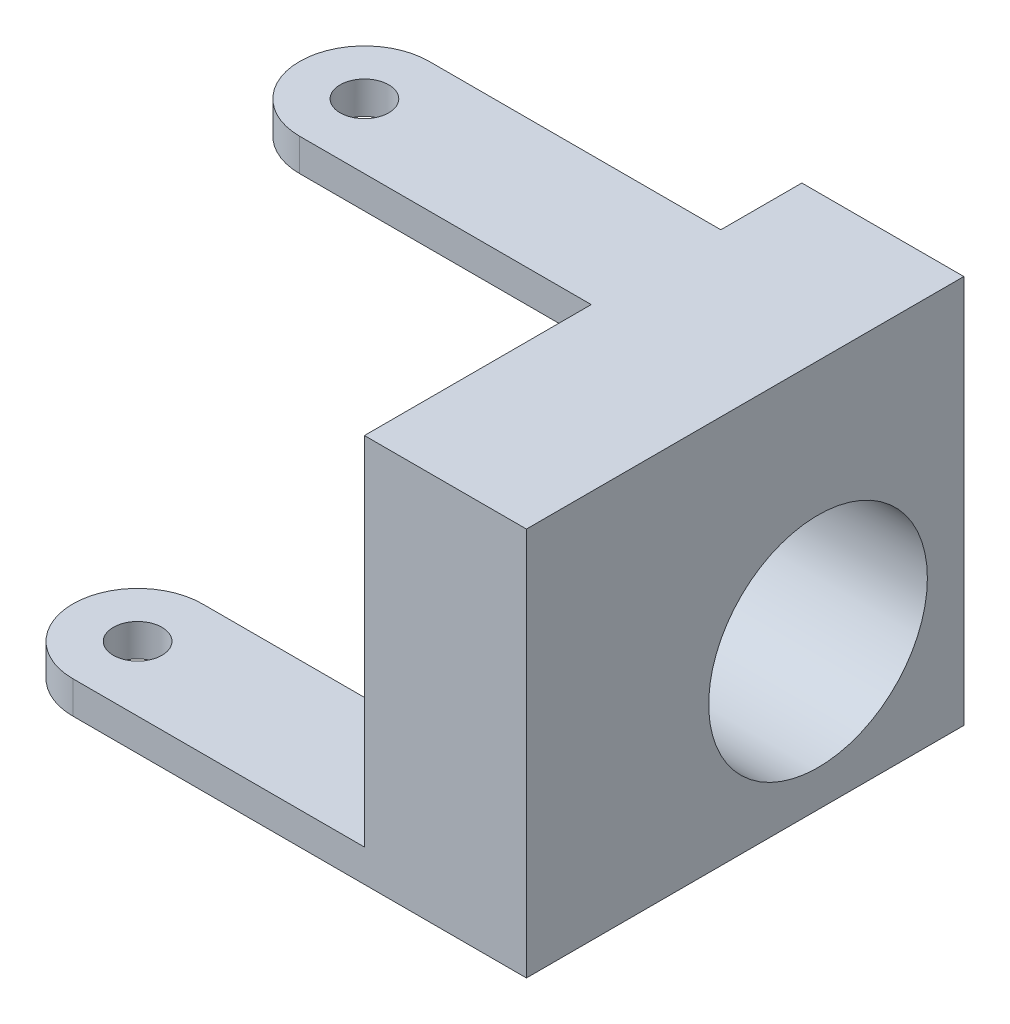
from build123d import *

# Parameters (mm, degrees)
SKETCH2_W           = 10
SKETCH2_H           = 27
BOSS_EXTRUDE1_DEPTH = 24
SKETCH3_R           = 6.75
CUT_EXTRUDE1_DEPTH  = 10
SKETCH6_W           = 8
SKETCH6_H           = 2
BOSS_EXTRUDE2_DEPTH = 32
FILLET1_RADIUS      = 4
FILLET1_LENGTH      = 2
SKETCH8_R           = 1.5
CUT_EXTRUDE2_DEPTH  = 2
SKETCH10_W          = 8
SKETCH10_H          = 2
BOSS_EXTRUDE3_DEPTH = 22
FILLET2_RADIUS      = 4
FILLET2_LENGTH      = 2
SKETCH11_R          = 1.5
CUT_EXTRUDE4_DEPTH  = 2


with BuildPart() as part:
    # Sketch2 → Boss-Extrude1 (new body)
    with BuildSketch(Plane(origin=(0, 0, 0), x_dir=(1, 0, 0), z_dir=(0, 1, 0))):
        with Locations((0, -4.5)):
            Rectangle(SKETCH2_W, SKETCH2_H)
    extrude(amount=BOSS_EXTRUDE1_DEPTH)

    # Sketch3 → Cut-Extrude1 (cut)
    with BuildSketch(Plane(origin=(5, 0, 0), x_dir=(0, 0, -1), z_dir=(1, 0, 0))):
        with Locations((0, 9)):
            Circle(SKETCH3_R)
    extrude(amount=-CUT_EXTRUDE1_DEPTH, mode=Mode.SUBTRACT)

    # Sketch6 → Boss-Extrude2 (add)
    with BuildSketch(Plane(origin=(5, 0, 0), x_dir=(0, 0, -1), z_dir=(1, 0, 0))):
        with Locations((0, 23)):
            Rectangle(SKETCH6_W, SKETCH6_H)
    extrude(amount=-BOSS_EXTRUDE2_DEPTH)

    # Fillet1: full round fillet: the end face becomes a half cylinder, R = half its width
    fillet1_face = Plane((-27, 23, 0), x_dir=(0, 1, 0), z_dir=(-1, 0, 0))  # on the end face: x along it, z out of the body
    fillet1_slab = fillet1_face.offset(-FILLET1_RADIUS / 2) * Box(FILLET1_LENGTH, 2 * FILLET1_RADIUS, FILLET1_RADIUS, mode=Mode.PRIVATE)  # the body's end, R deep
    fillet1_round = Plane((-23, 23, 0), x_dir=(-1, 0, 0), z_dir=(0, 1, 0)) * Cylinder(FILLET1_RADIUS, FILLET1_LENGTH, mode=Mode.PRIVATE)  # its axis R under the face
    add(fillet1_slab - fillet1_round, mode=Mode.SUBTRACT)

    # Sketch8 → Cut-Extrude2 (cut)
    with BuildSketch(Plane(origin=(0, 24, 0), x_dir=(1, 0, 0), z_dir=(0, 1, 0))):
        with Locations(Location((-23, 0, 0), (0, 0, 270))):
            Circle(SKETCH8_R)
    extrude(amount=-CUT_EXTRUDE2_DEPTH, mode=Mode.SUBTRACT)

    # Sketch10 → Boss-Extrude3 (add)
    with BuildSketch(Plane.ZY.offset(5)):
        with Locations((14, 1)):
            Rectangle(SKETCH10_W, SKETCH10_H)
    extrude(amount=BOSS_EXTRUDE3_DEPTH)

    # Fillet2: full round fillet: the end face becomes a half cylinder, R = half its width
    fillet2_face = Plane((-27, 1, 14), x_dir=(0, 1, 0), z_dir=(-1, 0, 0))  # on the end face: x along it, z out of the body
    fillet2_slab = fillet2_face.offset(-FILLET2_RADIUS / 2) * Box(FILLET2_LENGTH, 2 * FILLET2_RADIUS, FILLET2_RADIUS, mode=Mode.PRIVATE)  # the body's end, R deep
    fillet2_round = Plane((-23, 1, 14), x_dir=(-1, 0, 0), z_dir=(0, 1, 0)) * Cylinder(FILLET2_RADIUS, FILLET2_LENGTH, mode=Mode.PRIVATE)  # its axis R under the face
    add(fillet2_slab - fillet2_round, mode=Mode.SUBTRACT)

    # Sketch11 → Cut-Extrude4 (cut)
    with BuildSketch(Plane(origin=(0, 2, 0), x_dir=(1, 0, 0), z_dir=(0, 1, 0))):
        with Locations(Location((-23, -14, 0), (0, 0, 270))):
            Circle(SKETCH11_R)
    extrude(amount=-CUT_EXTRUDE4_DEPTH, mode=Mode.SUBTRACT)


solid = part.part
